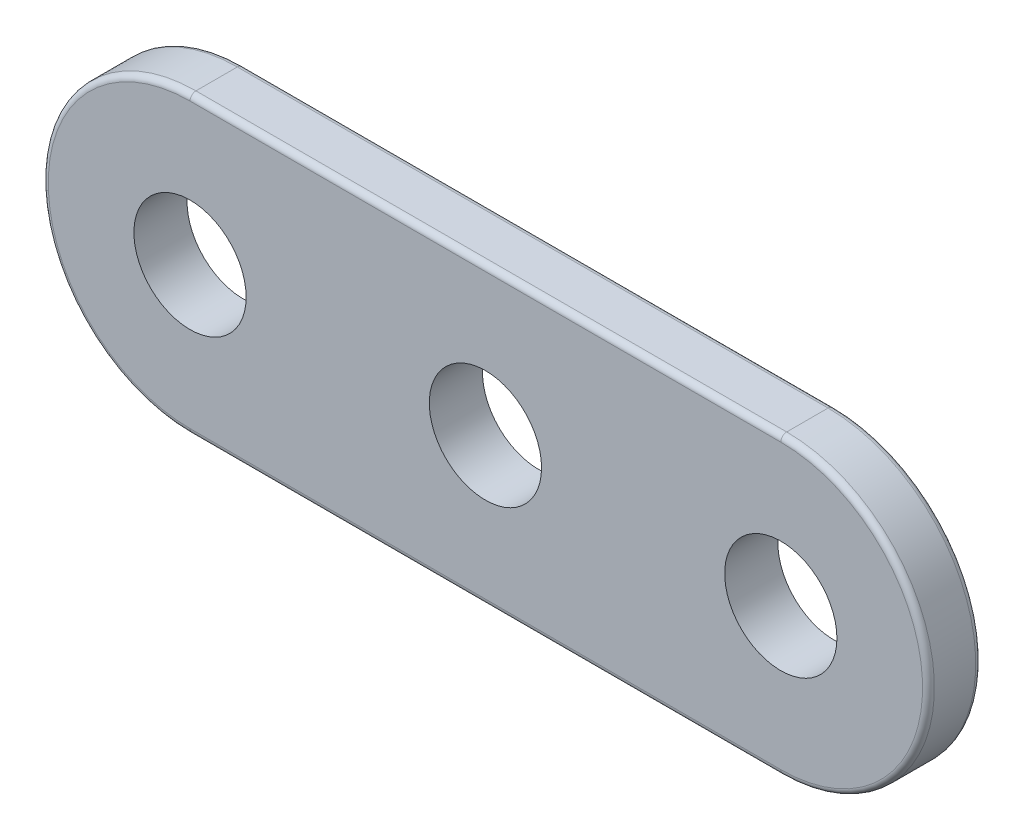
from build123d import *

# Parameters (mm, degrees)
EXTRUDE1_DEPTH  = 2.286
SKETCH2_R       = 2.413
EXTRUDE2_DEPTH  = 21.21016566
LPATTERN1_COUNT = 3
LPATTERN1_PITCH = 12.7
FILLET1_R       = 0.254


with BuildPart() as part:
    # Sketch1 → Extrude1 (new body)
    with BuildSketch(Plane.XY):
        with BuildLine():
            Line((-12.7, 6.35), (12.7, 6.35))
            ThreePointArc((12.7, 6.35), (19.05, 0), (12.7, -6.35))
            Line((12.7, -6.35), (-12.7, -6.35))
            ThreePointArc((-12.7, -6.35), (-19.05, 0), (-12.7, 6.35))
        make_face()
    extrude(amount=EXTRUDE1_DEPTH)

    # Sketch2 → Extrude2 (cut, through all)
    with BuildSketch(Plane.XY.offset(2.286)):
        with Locations((-12.7, 0)):
            Circle(SKETCH2_R)
    extrude2 = extrude(amount=-EXTRUDE2_DEPTH, mode=Mode.SUBTRACT)

    # LPattern1: Extrude2 ×3
    with Locations(*[(i * LPATTERN1_PITCH, 0, 0) for i in range(1, LPATTERN1_COUNT)]):
        add(extrude2, mode=Mode.SUBTRACT)

    # Fillet1
    fillet1_edges = [part.edges().sort_by_distance(p)[0] for p in [
        (19.05, 0, 2.286),
        (0, 6.35, 2.286),
        (-19.05, 0, 2.286),
        (0, 6.35, 0),
        (19.05, 0, 0),
        (0, -6.35, 0),
        (-19.05, 0, 0),
        (0, -6.35, 2.286),
    ]]
    fillet(fillet1_edges, radius=FILLET1_R)


solid = part.part
